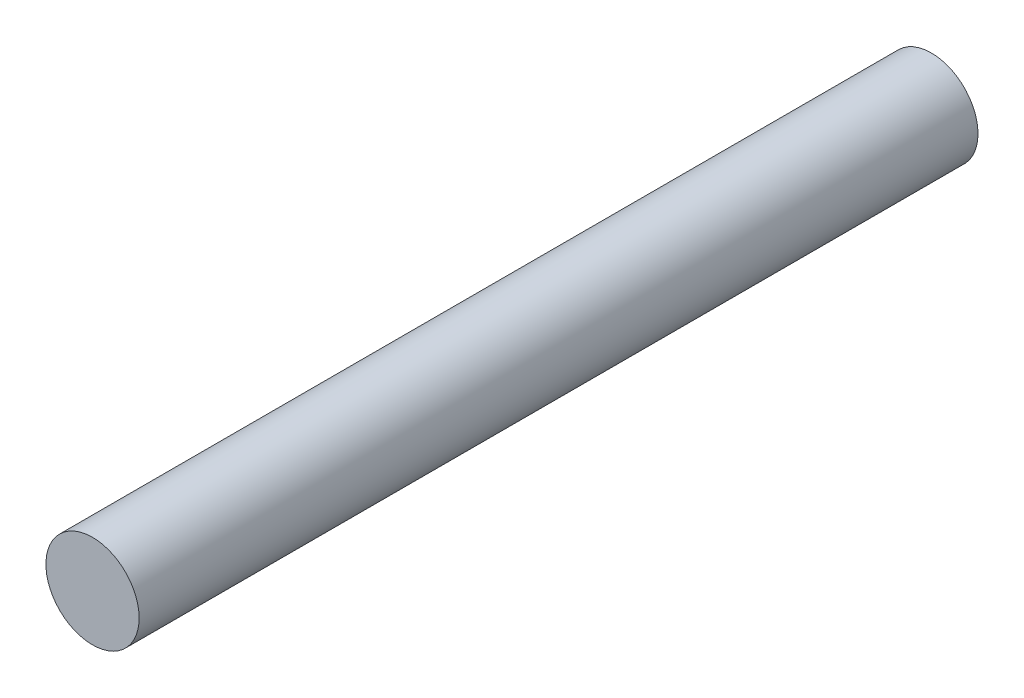
from build123d import *

# Parameters (mm, degrees)
SKETCH_1_R      = 3.5
EXTRUDE_1_DEPTH = 63


with BuildPart() as part:
    # 草图1 → 凸台-拉伸1 (new body)
    with BuildSketch(Plane.XY):
        with Locations((-11.445354665, 3.605529289)):
            Circle(SKETCH_1_R)
    extrude(amount=EXTRUDE_1_DEPTH)


solid = part.part
